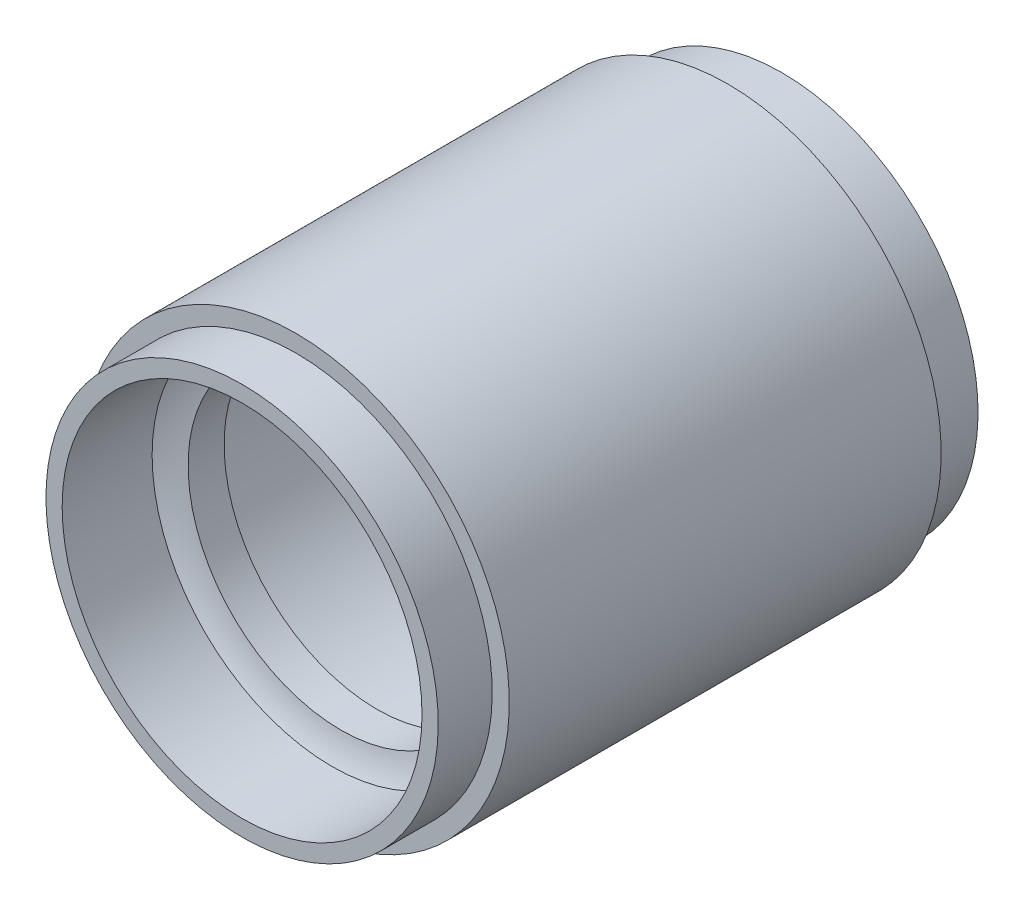
from build123d import *


with BuildPart() as part:
    # 스케치1 → 회전1 (revolve)
    with BuildSketch(Plane(origin=(0, 0, 0), x_dir=(0, 0, -1), z_dir=(1, 0, 0))):
        with BuildLine():
            Line((12, 11.85), (-12, 11.85))
            Line((-12, 11.85), (-12, 10.9))
            Line((-12, 10.9), (-15, 10.9))
            Line((-15, 10.9), (-15, 10))
            Line((-15, 10), (-10, 10))
            ThreePointArc((-10, 10), (-9.688420677, 9.270526441), (-9.5, 8.5))
            Line((-9.5, 8.5), (-7.5, 8.5))
            Line((-7.5, 8.5), (-6.817399349, 10.732369836))
            Line((-6.817399349, 10.732369836), (6.817399349, 10.732369836))
            Line((6.817399349, 10.732369836), (7.5, 8.5))
            Line((7.5, 8.5), (9.5, 8.5))
            ThreePointArc((9.5, 8.5), (9.688420677, 9.270526441), (10, 10))
            Line((10, 10), (15, 10))
            Line((15, 10), (15, 10.9))
            Line((15, 10.9), (12, 10.9))
            Line((12, 10.9), (12, 11.85))
        make_face()
    revolve(axis=Axis((0, 0, 0), (0, 0, 1)))


solid = part.part
